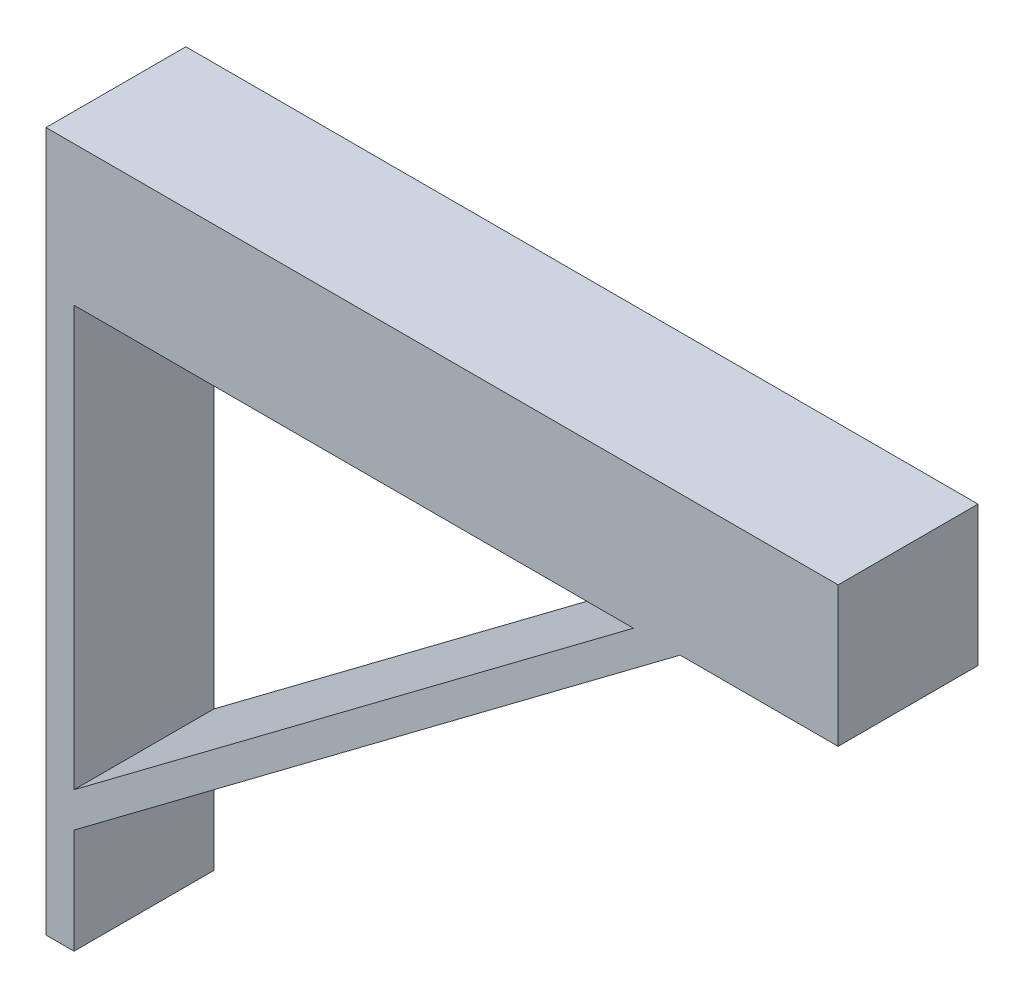
from build123d import *

# Parameters (mm, degrees)
BOSS_EXTRUDE1_DEPTH = 20


with BuildPart() as part:
    # Sketch1 → Boss-Extrude1 (new body)
    with BuildSketch(Plane.XY):
        Polygon((65.303956044, 33.516483516), (-43.956043956, 33.516483516), (-47.956043956, 33.516483516), (-47.956043956, -66.483516484), (-43.956043956, -66.483516484), (-43.956043956, -51.483516484), (42.710622711, 13.516483516), (65.303956044, 13.516483516), align=None)
        Polygon((36.043956044, 13.516483516), (-43.956043956, -46.483516484), (-43.956043956, 13.516483516), align=None, mode=Mode.SUBTRACT)
    extrude(amount=BOSS_EXTRUDE1_DEPTH)


solid = part.part
